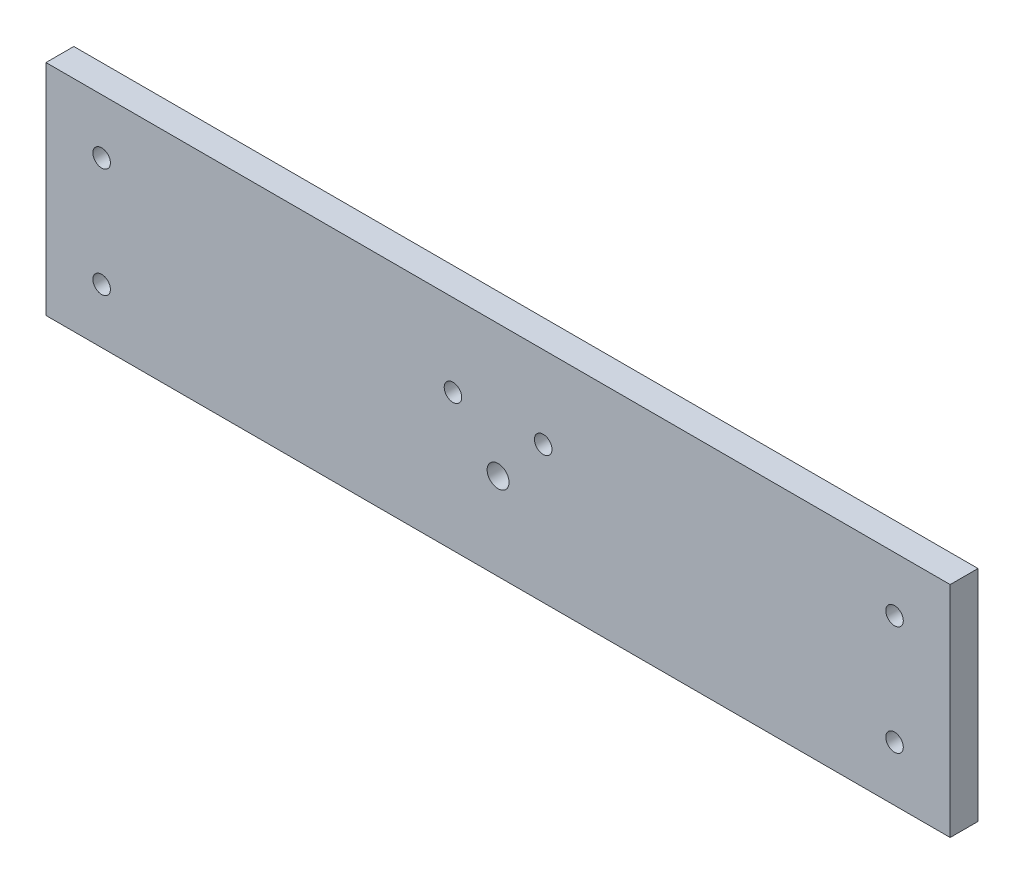
from build123d import *

# Parameters (mm, degrees)
SKETCH1_W           = 412.7
SKETCH1_H           = 100
SKETCH1_R           = 4
SKETCH1_R_2         = 5
BOSS_EXTRUDE1_DEPTH = 12.7
CUT_EXTRUDE1_REACH  = 214.701
SKETCH2_R           = 4


with BuildPart() as part:
    # Sketch1 → Boss-Extrude1 (new body)
    with BuildSketch(Plane.XY):
        Rectangle(SKETCH1_W, SKETCH1_H)
        with Locations((-20.590065585, 12.533614425)):
            Circle(SKETCH1_R, mode=Mode.SUBTRACT)
        with Locations((20.590065585, 12.533614425)):
            Circle(SKETCH1_R, mode=Mode.SUBTRACT)
        with Locations((0, -10.30151519)):
            Circle(SKETCH1_R_2, mode=Mode.SUBTRACT)
    extrude(amount=BOSS_EXTRUDE1_DEPTH)

    # Sketch2 → Cut-Extrude1 (cut, up to next)
    with BuildSketch(Plane.XY.offset(12.7), mode=Mode.PRIVATE) as cut_extrude1_sk1:
        with Locations((-180.95, 25)):
            Circle(SKETCH2_R)
    cut_extrude1_tool1 = extrude(cut_extrude1_sk1.sketch, amount=-CUT_EXTRUDE1_REACH, mode=Mode.PRIVATE) & part.part
    # Sketch2 → Cut-Extrude1 (cut, up to next)
    with BuildSketch(Plane.XY.offset(12.7), mode=Mode.PRIVATE) as cut_extrude1_sk2:
        with Locations((-180.95, -25)):
            Circle(SKETCH2_R)
    cut_extrude1_tool2 = extrude(cut_extrude1_sk2.sketch, amount=-CUT_EXTRUDE1_REACH, mode=Mode.PRIVATE) & part.part
    # Sketch2 → Cut-Extrude1 (cut, up to next)
    with BuildSketch(Plane.XY.offset(12.7), mode=Mode.PRIVATE) as cut_extrude1_sk3:
        with Locations((180.95, -25)):
            Circle(SKETCH2_R)
    cut_extrude1_tool3 = extrude(cut_extrude1_sk3.sketch, amount=-CUT_EXTRUDE1_REACH, mode=Mode.PRIVATE) & part.part
    # Sketch2 → Cut-Extrude1 (cut, up to next)
    with BuildSketch(Plane.XY.offset(12.7), mode=Mode.PRIVATE) as cut_extrude1_sk4:
        with Locations((180.95, 25)):
            Circle(SKETCH2_R)
    cut_extrude1_tool4 = extrude(cut_extrude1_sk4.sketch, amount=-CUT_EXTRUDE1_REACH, mode=Mode.PRIVATE) & part.part
    add(cut_extrude1_tool1.solids().sort_by_distance((-180.95, 25, 12.7))[0], mode=Mode.SUBTRACT)
    add(cut_extrude1_tool2.solids().sort_by_distance((-180.95, -25, 12.7))[0], mode=Mode.SUBTRACT)
    add(cut_extrude1_tool3.solids().sort_by_distance((180.95, -25, 12.7))[0], mode=Mode.SUBTRACT)
    add(cut_extrude1_tool4.solids().sort_by_distance((180.95, 25, 12.7))[0], mode=Mode.SUBTRACT)


solid = part.part
